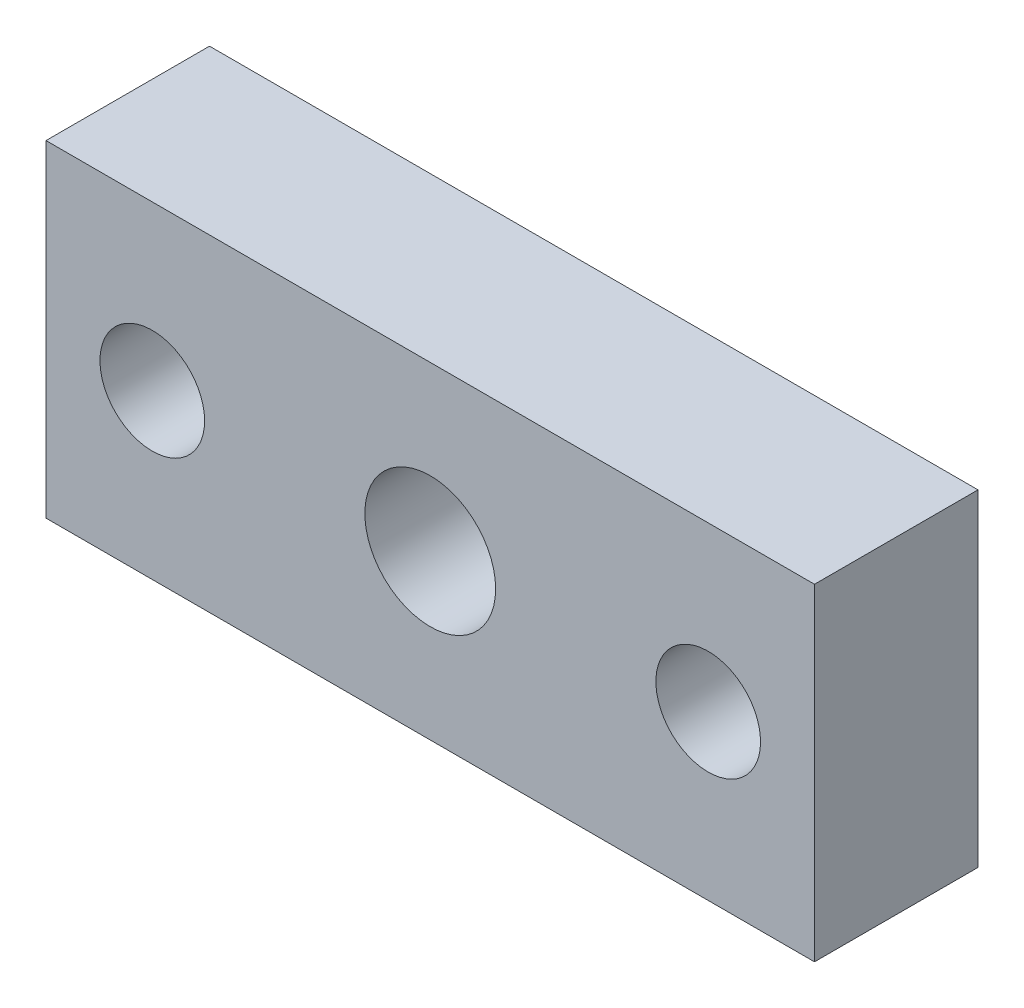
from build123d import *

# Parameters (mm, degrees)
SKETCH_1_W          = 23.5
SKETCH_1_H          = 10
SKETCH_1_R          = 1.6
EXTRUDE_1_DEPTH     = 5
SKETCH_2_R          = 2
CUT_EXTRUDE_1_DEPTH = 10


with BuildPart() as part:
    # 草图1 → 凸台-拉伸1 (new body)
    with BuildSketch(Plane.XY):
        Rectangle(SKETCH_1_W, SKETCH_1_H)
        with Locations((-8.5, 0)):
            Circle(SKETCH_1_R, mode=Mode.SUBTRACT)
        with Locations((8.5, 0)):
            Circle(SKETCH_1_R, mode=Mode.SUBTRACT)
    extrude(amount=EXTRUDE_1_DEPTH)

    # 草图2 → 切除-拉伸1 (cut)
    with BuildSketch(Plane.XY.offset(5)):
        Circle(SKETCH_2_R)
    extrude(amount=-CUT_EXTRUDE_1_DEPTH, mode=Mode.SUBTRACT)


solid = part.part
